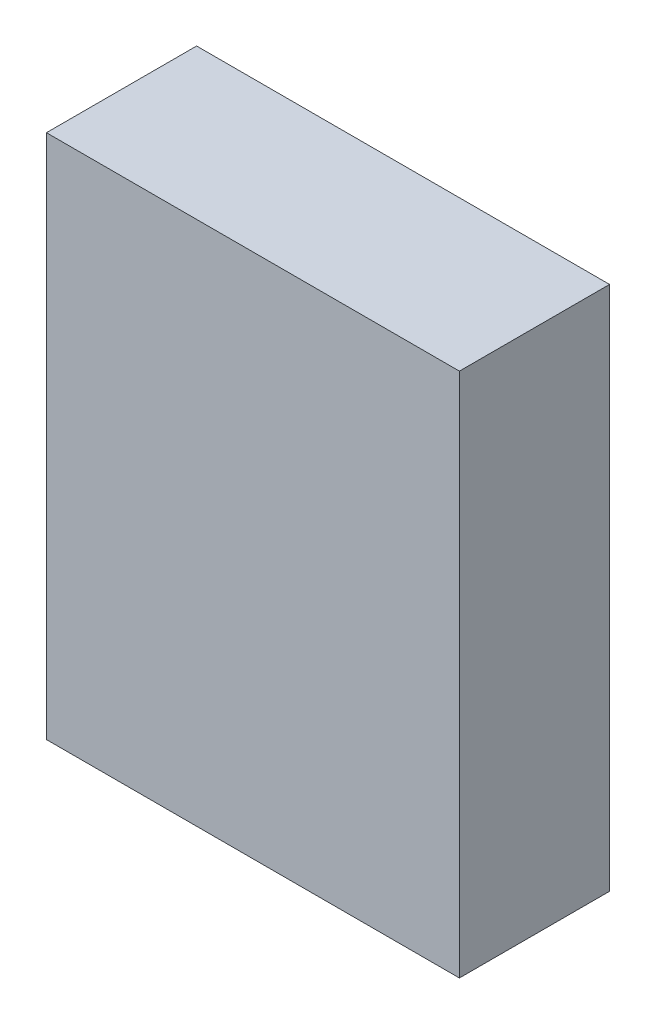
from build123d import *

# Parameters (mm, degrees)
SKETCH1_W           = 55
SKETCH1_H           = 70
BOSS_EXTRUDE1_DEPTH = 20


with BuildPart() as part:
    # Sketch1 → Boss-Extrude1 (new body)
    with BuildSketch(Plane.XY):
        Rectangle(SKETCH1_W, SKETCH1_H)
    extrude(amount=BOSS_EXTRUDE1_DEPTH)


solid = part.part
